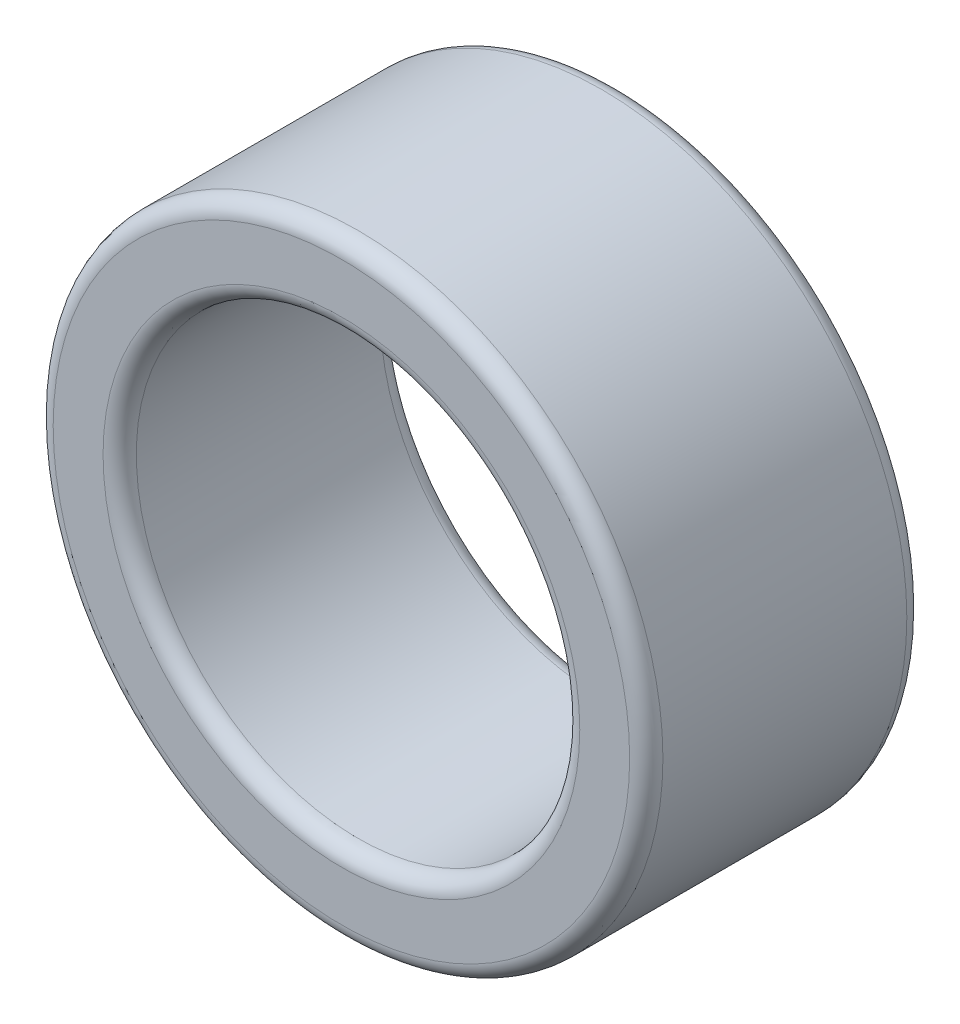
from build123d import *

# Parameters (mm, degrees)
SKETCH1_R           = 5.5
SKETCH1_R_2         = 4
BOSS_EXTRUDE1_DEPTH = 5
FILLET1_R           = 0.3
FILLET2_R           = 0.3
FILLET3_R           = 0.3


with BuildPart() as part:
    # Sketch1 → Boss-Extrude1 (new body)
    with BuildSketch(Plane.XY):
        Circle(SKETCH1_R)
        Circle(SKETCH1_R_2, mode=Mode.SUBTRACT)
    extrude(amount=BOSS_EXTRUDE1_DEPTH)

    # Fillet1
    fillet1_edges = [part.edges().sort_by_distance(p)[0] for p in [
        (-5.5, 0, 0),
    ]]
    fillet(fillet1_edges, radius=FILLET1_R)

    # Fillet2
    fillet2_edges = [part.edges().sort_by_distance(p)[0] for p in [
        (-4, 0, 0),
    ]]
    fillet(fillet2_edges, radius=FILLET2_R)

    # Fillet3
    fillet3_edges = [part.edges().sort_by_distance(p)[0] for p in [
        (-5.5, 0, 5),
        (-4, 0, 5),
    ]]
    fillet(fillet3_edges, radius=FILLET3_R)


solid = part.part
